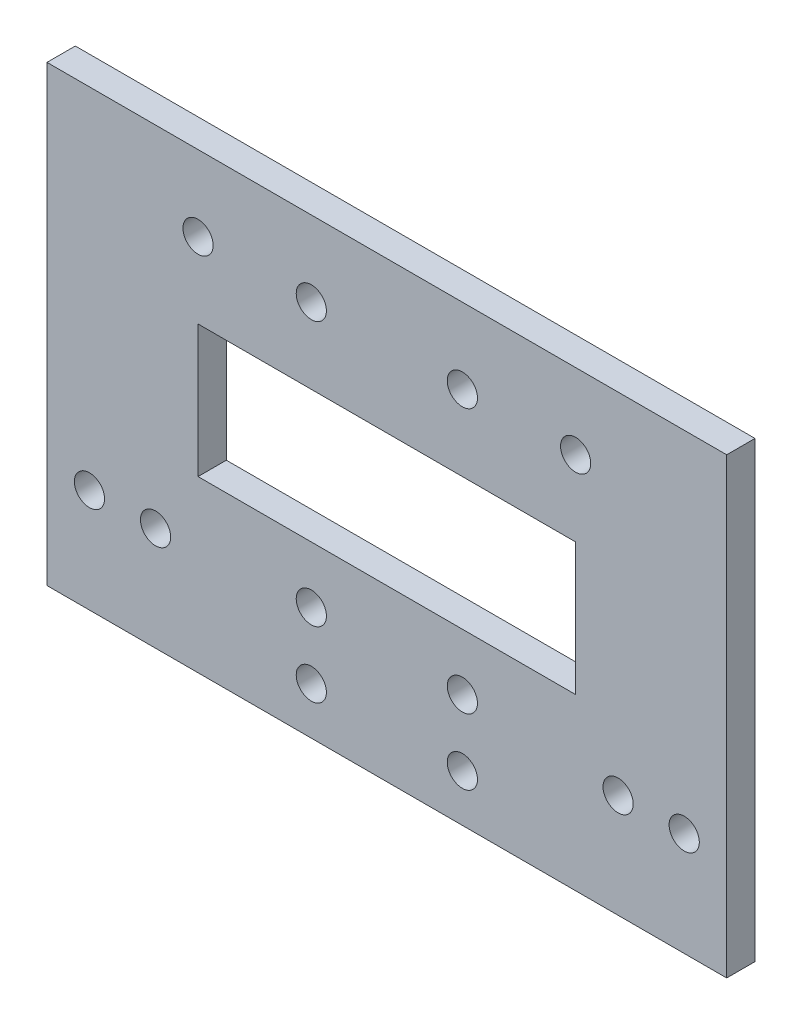
from build123d import *

# Parameters (mm, degrees)
SKETCH_1_W          = 40
SKETCH_1_H          = 14
EXTRUDE_2_DEPTH     = 3
SKETCH_2_R          = 1.6
CUT_EXTRUDE_1_DEPTH = 10
SKETCH_3_R          = 1.6
CUT_EXTRUDE_2_DEPTH = 87.585218138


with BuildPart() as part:
    # 草图1 → 凸台-拉伸2 (new body)
    with BuildSketch(Plane.XY):
        Polygon((0, 0), (0, 48), (72, 48), (72, 0), (56, 0), (16, 0), align=None)
        with Locations((36, 25)):
            Rectangle(SKETCH_1_W, SKETCH_1_H, mode=Mode.SUBTRACT)
    extrude(amount=EXTRUDE_2_DEPTH)

    # 草图2 → 切除-拉伸1 (cut)
    with BuildSketch(Plane(origin=(0, 0, 0), x_dir=(-1, 0, 0), z_dir=(0, 0, -1))):
        with Locations((-44, 12)):
            Circle(SKETCH_2_R)
        with Locations((-28, 12)):
            Circle(SKETCH_2_R)
        with Locations((-44, 40)):
            Circle(SKETCH_2_R)
        with Locations((-28, 40)):
            Circle(SKETCH_2_R)
        with Locations((-56, 40)):
            Circle(SKETCH_2_R)
        with Locations((-16, 40)):
            Circle(SKETCH_2_R)
        with Locations((-44, 5)):
            Circle(SKETCH_2_R)
        with Locations((-28, 5)):
            Circle(SKETCH_2_R)
    extrude(amount=-CUT_EXTRUDE_1_DEPTH, mode=Mode.SUBTRACT)

    # 草图3 → 切除-拉伸2 (cut, through all)
    with BuildSketch(Plane.XY.offset(3)):
        with Locations((67.5, 11)):
            Circle(SKETCH_3_R)
        with Locations((60.5, 11)):
            Circle(SKETCH_3_R)
        with Locations((4.5, 11)):
            Circle(SKETCH_3_R)
        with Locations((11.5, 11)):
            Circle(SKETCH_3_R)
    extrude(amount=-CUT_EXTRUDE_2_DEPTH, mode=Mode.SUBTRACT)


solid = part.part
